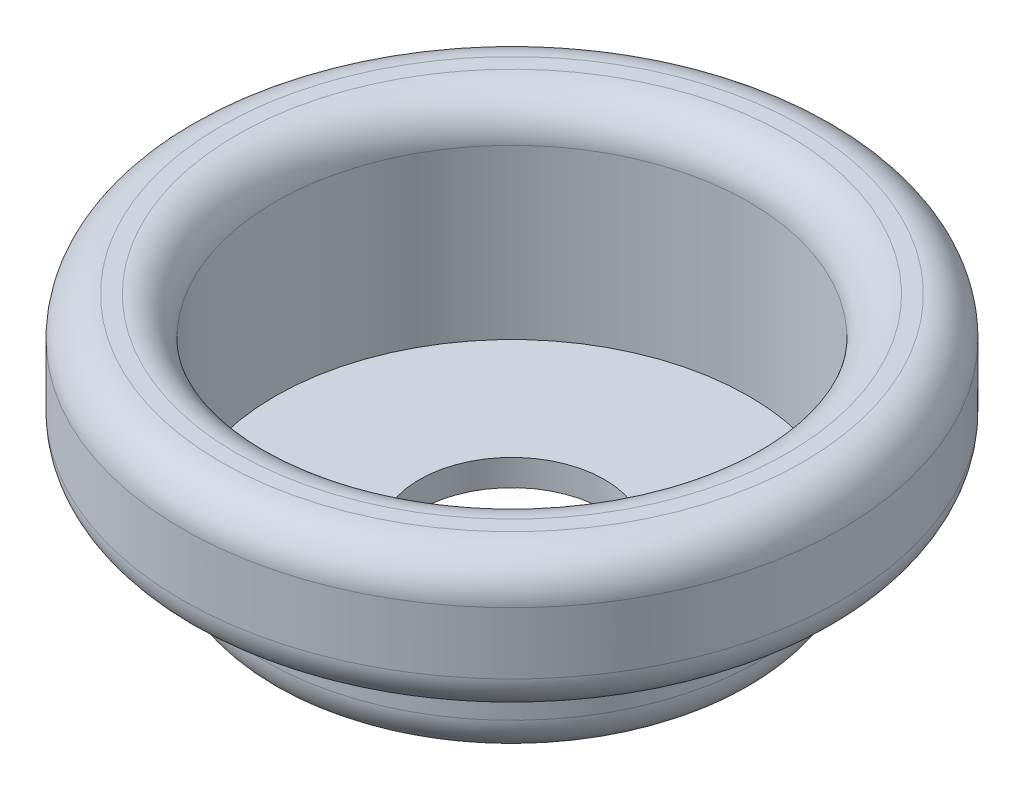
from build123d import *

# Parameters (mm, degrees)
FILLET1_R = 0.635


with BuildPart() as part:
    # Sketch1 → Revolve1 (revolve)
    with BuildSketch(Plane.XY, mode=Mode.PRIVATE) as revolve1_sk:
        Polygon((-4.064, 0), (-1.524, 0), (-1.524, 0.4318), (-3.8989, 0.4318), (-3.8989, 3.8354), (-5.4229, 3.8354), (-5.4229, 1.5494), (-4.064, 1.5494), align=None)
    revolve(revolve1_sk.sketch.rotate(Axis((0, 0, 0), (0, 1, 0)), 270), axis=Axis((0, 0, 0), (0, 1, 0)))

    # Fillet1
    fillet1_edges = [part.edges().sort_by_distance(p)[0] for p in [
        (0, 1.5494, 4.064),
        (0, 1.5494, 5.4229),
        (0, 3.8354, 5.4229),
        (0, 3.8354, 3.8989),
        (0, 0, 4.064),
    ]]
    fillet(fillet1_edges, radius=FILLET1_R)


solid = part.part
